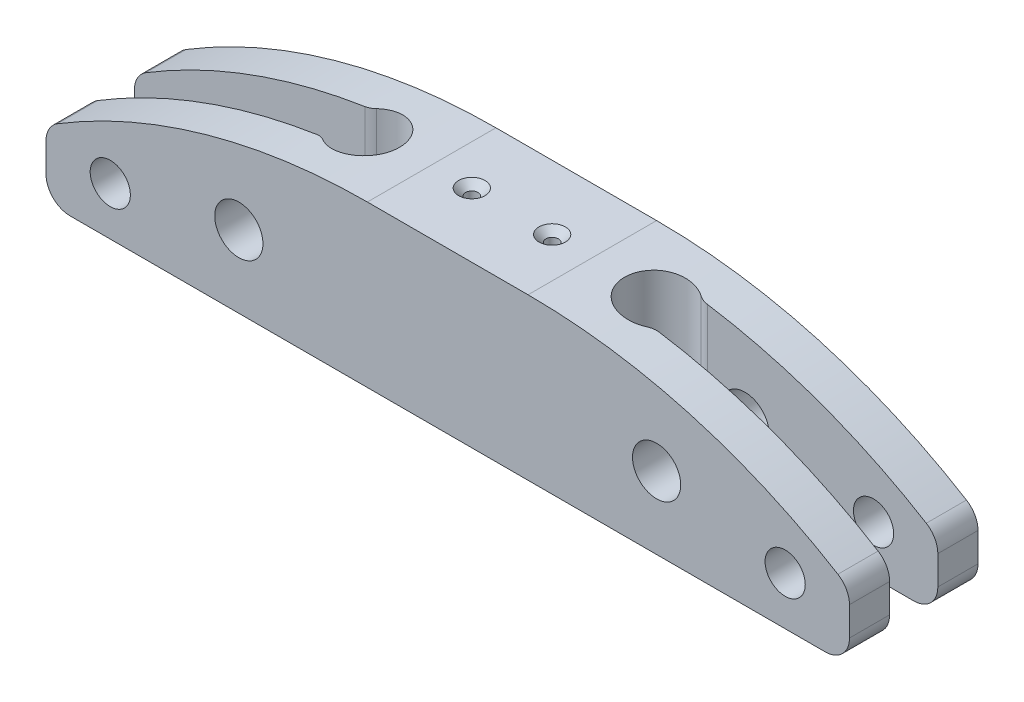
from build123d import *

# Parameters (mm, degrees)
BOSS_EXTRUDE1_DEPTH                               = 20
SKETCH2_R                                         = 6.25
SKETCH2_R_2                                       = 7.5
CUT_EXTRUDE1_DEPTH                                = 141.445719052
SKETCH3_R                                         = 10
SKETCH3_W                                         = 80
SKETCH3_H                                         = 15
CUT_EXTRUDE3_DEPTH                                = 137.106575888
CSK_FOR_M3_5_FLAT_HEAD_MACHINE_SCREW1_D           = 3.9
CSK_FOR_M3_5_FLAT_HEAD_MACHINE_SCREW1_CSINK_D     = 8.2
CSK_FOR_M3_5_FLAT_HEAD_MACHINE_SCREW1_CSINK_ANGLE = 90
FILLET2_R                                         = 7.5
FILLET4_R                                         = 5
FILLET2_OF_MIRROR2_R                              = 7.5
FILLET4_OF_MIRROR2_R                              = 5


with BuildPart() as part:
    # Sketch1 → Boss-Extrude1 (new, symmetric)
    with BuildSketch(Plane.XY):
        with BuildLine():
            Line((0, -50), (-125, -50))
            Line((-125, -50), (-125, -29.356175837))
            ThreePointArc((-125, -29.356175837), (-77.109944012, -7.490693948), (-25, 0))
            Line((-25, 0), (0, 0))
            Line((0, 0), (0, -50))
        make_face()
    boss_extrude1 = extrude(amount=BOSS_EXTRUDE1_DEPTH, both=True)

    # Sketch2 → Cut-Extrude1 (cut, through all)
    with BuildSketch(Plane.XY.offset(20)):
        with Locations((-105, -35)):
            Circle(SKETCH2_R)
        with Locations((-65, -27.5)):
            Circle(SKETCH2_R_2)
    cut_extrude1 = extrude(amount=-CUT_EXTRUDE1_DEPTH, mode=Mode.SUBTRACT)

    # Sketch3 → Cut-Extrude3 (cut, through all)
    with BuildSketch(Plane(origin=(0, -50, 0), x_dir=(-1, 0, 0), z_dir=(0, -1, 0))):
        with Locations((45, 0)):
            Circle(SKETCH3_R)
        with Locations((85, 0)):
            Rectangle(SKETCH3_W, SKETCH3_H)
    cut_extrude3 = extrude(amount=-CUT_EXTRUDE3_DEPTH, mode=Mode.SUBTRACT)

    # CSK for M3.5 Flat Head Machine Screw1 (through all)
    with Locations(Plane(origin=(0, 0, 0), x_dir=(1, 0, 0), z_dir=(0, 1, 0))):
        with Locations((-12.5, 0)):
            csk_for_m3_5_flat_head_machine_screw1 = CounterSinkHole(CSK_FOR_M3_5_FLAT_HEAD_MACHINE_SCREW1_D / 2, CSK_FOR_M3_5_FLAT_HEAD_MACHINE_SCREW1_CSINK_D / 2, counter_sink_angle=CSK_FOR_M3_5_FLAT_HEAD_MACHINE_SCREW1_CSINK_ANGLE)

    # Fillet2
    fillet2_edges = [part.edges().sort_by_distance(p)[0] for p in [
        (-125, -50, -13.75),
        (-125, -29.356175837, -13.75),
        (-125, -50, 13.75),
        (-125, -29.356175837, 13.75),
    ]]
    fillet(fillet2_edges, radius=FILLET2_R)

    # Fillet4
    fillet4_edges = [part.edges().sort_by_distance(p)[0] for p in [
        (-51.614378278, -25.96220061, 7.5),
        (-51.614378278, -25.96220061, -7.5),
    ]]
    fillet(fillet4_edges, radius=FILLET4_R)

    # Mirror2: Boss-Extrude1, Cut-Extrude1, Cut-Extrude3, CSK for M3.5 Flat Head Machine Screw1 across plane
    add(boss_extrude1.mirror(Plane(origin=(0, 0, 20), x_dir=(0, 0, 1), z_dir=(-1, 0, 0))))
    add(cut_extrude1.mirror(Plane(origin=(0, 0, 20), x_dir=(0, 0, 1), z_dir=(-1, 0, 0))), mode=Mode.SUBTRACT)
    add(cut_extrude3.mirror(Plane(origin=(0, 0, 20), x_dir=(0, 0, 1), z_dir=(-1, 0, 0))), mode=Mode.SUBTRACT)
    add(csk_for_m3_5_flat_head_machine_screw1.mirror(Plane(origin=(0, 0, 20), x_dir=(0, 0, 1), z_dir=(-1, 0, 0))), mode=Mode.SUBTRACT)

    # Fillet2 of Mirror2
    fillet2_of_mirror2_edges = [part.edges().sort_by_distance(p)[0] for p in [
        (125, -50, -13.75),
        (125, -29.356175837, -13.75),
        (125, -50, 13.75),
        (125, -29.356175837, 13.75),
    ]]
    fillet(fillet2_of_mirror2_edges, radius=FILLET2_OF_MIRROR2_R)

    # Fillet4 of Mirror2
    fillet4_of_mirror2_edges = [part.edges().sort_by_distance(p)[0] for p in [
        (51.614378278, -25.96220061, 7.5),
        (51.614378278, -25.96220061, -7.5),
    ]]
    fillet(fillet4_of_mirror2_edges, radius=FILLET4_OF_MIRROR2_R)


solid = part.part
